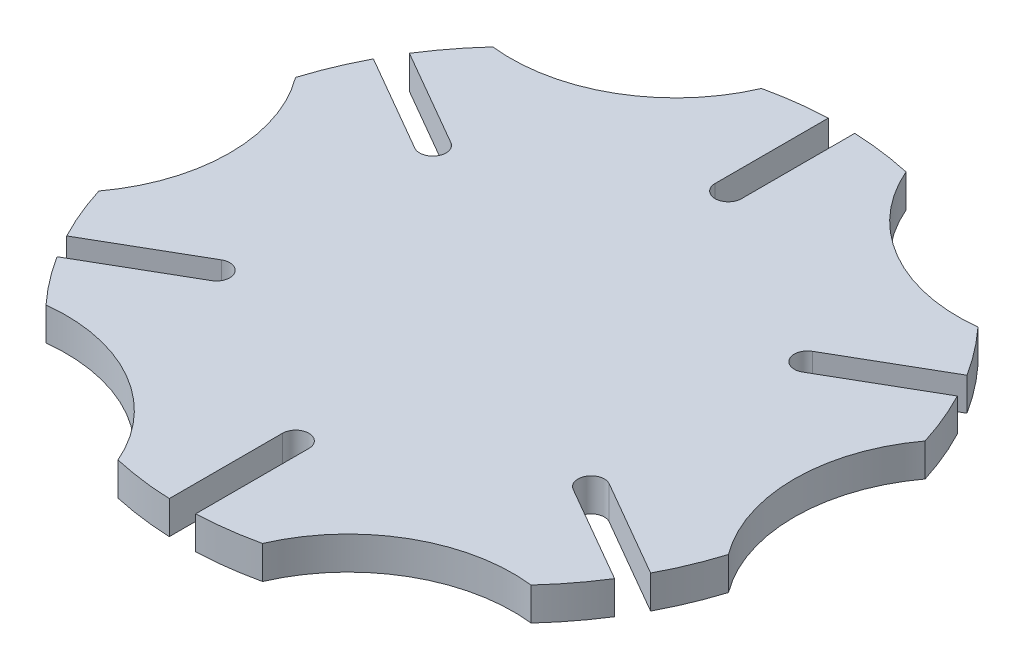
from build123d import *

# Parameters (mm, degrees)
BOSS_EXTRUDE1_DEPTH = 5


with BuildPart() as part:
    # Sketch1 → Boss-Extrude1 (new body)
    with BuildSketch(Plane(origin=(0, 0, 0), x_dir=(1, 0, 0), z_dir=(0, 1, 0))):
        with BuildLine():
            ThreePointArc((47.726299074, 14.90638711), (46.185164881, 19.155431211), (44.266615306, 23.247941186))
            Line((44.266615306, 23.247941186), (39.371782551, 20.421908177))
            ThreePointArc((39.371782551, 20.421908177), (32.796167617, 0), (39.371782551, -20.421908177))
            Line((39.371782551, -20.421908177), (44.266615306, -23.247941186))
            ThreePointArc((44.266615306, -23.247941186), (46.185164881, -19.155431211), (47.726299074, -14.90638711))
            ThreePointArc((47.726299074, -14.90638711), (42.796167617, 0), (47.726299074, 14.90638711))
        make_face()
        with BuildLine():
            ThreePointArc((39.371782551, -20.421908177), (32.796167617, 0), (39.371782551, 20.421908177))
            Line((39.371782551, 20.421908177), (29.402314303, 14.666033001))
            ThreePointArc((29.402314303, 14.666033001), (26.670263496, 15.398083809), (27.402314303, 18.130134616))
            Line((27.402314303, 18.130134616), (42.266615306, 26.712042801))
            ThreePointArc((42.266615306, 26.712042801), (39.68167249, 30.41981046), (36.772459453, 33.878993872))
            ThreePointArc((36.772459453, 33.878993872), (21.398083809, 37.062568341), (10.953839621, 48.785380982))
            ThreePointArc((10.953839621, 48.785380982), (6.503492392, 49.575241671), (2, 49.959983987))
            Line((2, 49.959983987), (2, 32.796167617))
            ThreePointArc((2, 32.796167617), (0, 30.796167617), (-2, 32.796167617))
            Line((-2, 32.796167617), (-2, 49.959983987))
            ThreePointArc((-2, 49.959983987), (-6.503492392, 49.575241671), (-10.953839621, 48.785380982))
            ThreePointArc((-10.953839621, 48.785380982), (-21.398083809, 37.062568341), (-36.772459453, 33.878993872))
            ThreePointArc((-36.772459453, 33.878993872), (-39.68167249, 30.41981046), (-42.266615306, 26.712042801))
            Line((-42.266615306, 26.712042801), (-27.402314303, 18.130134616))
            ThreePointArc((-27.402314303, 18.130134616), (-26.670263496, 15.398083809), (-29.402314303, 14.666033001))
            Line((-29.402314303, 14.666033001), (-44.266615306, 23.247941186))
            ThreePointArc((-44.266615306, 23.247941186), (-46.185164881, 19.155431211), (-47.726299074, 14.90638711))
            ThreePointArc((-47.726299074, 14.90638711), (-44.060680329, 7.850263895), (-42.796167617, 0))
            ThreePointArc((-42.796167617, 0), (-44.060680329, -7.850263895), (-47.726299074, -14.90638711))
            ThreePointArc((-47.726299074, -14.90638711), (-46.185164881, -19.155431211), (-44.266615306, -23.247941186))
            Line((-44.266615306, -23.247941186), (-29.402314303, -14.666033001))
            ThreePointArc((-29.402314303, -14.666033001), (-26.670263496, -15.398083809), (-27.402314303, -18.130134616))
            Line((-27.402314303, -18.130134616), (-42.266615306, -26.712042801))
            ThreePointArc((-42.266615306, -26.712042801), (-39.68167249, -30.41981046), (-36.772459453, -33.878993872))
            ThreePointArc((-36.772459453, -33.878993872), (-21.398083809, -37.062568341), (-10.953839621, -48.785380982))
            ThreePointArc((-10.953839621, -48.785380982), (-6.503492392, -49.575241671), (-2, -49.959983987))
            Line((-2, -49.959983987), (-2, -32.796167617))
            ThreePointArc((-2, -32.796167617), (0, -30.796167617), (2, -32.796167617))
            Line((2, -32.796167617), (2, -49.959983987))
            ThreePointArc((2, -49.959983987), (6.503492392, -49.575241671), (10.953839621, -48.785380982))
            ThreePointArc((10.953839621, -48.785380982), (21.398083809, -37.062568341), (36.772459453, -33.878993872))
            ThreePointArc((36.772459453, -33.878993872), (39.68167249, -30.41981046), (42.266615306, -26.712042801))
            Line((42.266615306, -26.712042801), (27.402314303, -18.130134616))
            ThreePointArc((27.402314303, -18.130134616), (26.670263496, -15.398083809), (29.402314303, -14.666033001))
            Line((29.402314303, -14.666033001), (39.371782551, -20.421908177))
        make_face()
    extrude(amount=BOSS_EXTRUDE1_DEPTH)


solid = part.part
